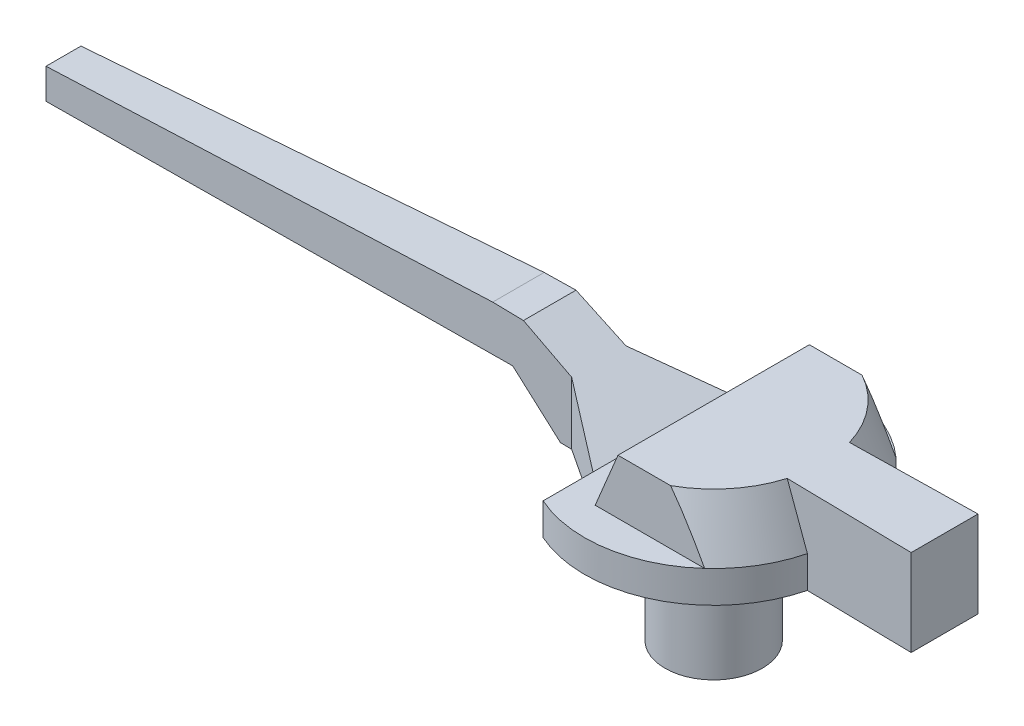
from build123d import *

# Parameters (mm, degrees)
EXTRUDE_1_REACH          = 11.113
SKETCH_3_OUTSIDE_W       = 37.198
SKETCH_3_OUTSIDE_H       = 16.698
SKETCH_3_OUTSIDE_W_2     = 45.46824203
SKETCH_3_OUTSIDE_H_2     = 6.3
CUT_EXTRUDE_1_DEPTH      = 1.8
CUT_EXTRUDE_2_DEPTH      = 24.65676436
CUT_EXTRUDE_4_DEPTH      = 23.39475385
CUT_EXTRUDE_4_DEPTH_BACK = 23.39475385


with BuildPart() as part:
    # Эскиз1 → Повернуть1 (revolve)
    with BuildSketch(Plane(origin=(0, 0, 0), x_dir=(0, 0, -1), z_dir=(1, 0, 0))):
        Polygon((-0.45, 0), (-1.6, 0), (-1.6, 4), (-4.25, 4), (-4.25, 5.05), (-3.594853578, 6.85), (0, 6.85), (0, 5), (-0.45, 5), align=None)
    revolve(axis=Axis((0, 0, 0), (0, -1, 0)))

    # Бобышка-Вытянуть1: up to this face of the body (flat: up to its plane)
    extrude_1_end = Plane(part.part.faces().sort_by_distance((0, 4, -1.720208153))[0])
    # Эскиз2 → Бобышка-Вытянуть1 (add, up to the picked face)
    with BuildSketch(Plane(origin=(0, 6.85, 0), x_dir=(1, 0, 0), z_dir=(0, 1, 0)), mode=Mode.PRIVATE) as extrude_1_sk1:
        Polygon((-21.4, -0.575), (-21.4, 0.575), (7.6, 1.1), (7.6, -1.1), align=None)
    extrude_1_tool1 = split(extrude(extrude_1_sk1.sketch, amount=-EXTRUDE_1_REACH, mode=Mode.PRIVATE), bisect_by=extrude_1_end, keep=Keep.BOTH, mode=Mode.PRIVATE)
    add(extrude_1_tool1.solids().sort_by(Axis((-5.385075, 6.85, 0), (0, -1, 0)))[0])

    # Эскиз3 outside → Вырез-Вытянуть1 (cut)
    with BuildSketch(Plane(origin=(0, 6.85, 0), x_dir=(1, 0, 0), z_dir=(0, 1, 0))):
        with Locations((-6.9, 0)):
            Rectangle(SKETCH_3_OUTSIDE_W, SKETCH_3_OUTSIDE_H)
        Rectangle(SKETCH_3_OUTSIDE_W_2, SKETCH_3_OUTSIDE_H_2, mode=Mode.SUBTRACT)
    extrude(amount=-CUT_EXTRUDE_1_DEPTH, mode=Mode.SUBTRACT)

    # Эскиз4 → Вырез-Вытянуть2 (cut, through all)
    with BuildSketch(Plane.XY.offset(3.15)):
        Polygon((0, 6.85), (-0.749299763, 5.05), (-1.732187129, 5.05), (-5.395285576, 6.85), align=None)
        Polygon((-6.4250568, 6.85), (-21.4, 5.95), (-21.4, 6.85), align=None)
        Polygon((-21.4, 4.95), (-5.756816797, 5.373014976), (-4.15637233, 4), (-21.4, 4), align=None)
    extrude(amount=-CUT_EXTRUDE_2_DEPTH, mode=Mode.SUBTRACT)

    # Эскиз5 → Вырез-Вытянуть4 (cut, two sides: drawn at the far end of the back side and taken through both)
    with BuildSketch(Plane(origin=(0, 5.05, 0), x_dir=(1, 0, 0), z_dir=(0, 1, 0)).offset(-CUT_EXTRUDE_4_DEPTH_BACK)):
        Polygon((-1.732187129, 4.790977117), (-1.732187129, 2.23974472), (-3.779539394, 0.893991097), (-5.395285576, 0.86474052), (-3.779539394, 4.790977117), align=None)
        Polygon((-5.395285576, -0.86474052), (-3.779539394, -4.790977117), (-1.732187129, -4.790977117), (-1.732187129, -2.23974472), (-3.779539394, -0.893991097), align=None)
    extrude(amount=CUT_EXTRUDE_4_DEPTH + CUT_EXTRUDE_4_DEPTH_BACK, mode=Mode.SUBTRACT)


solid = part.part
